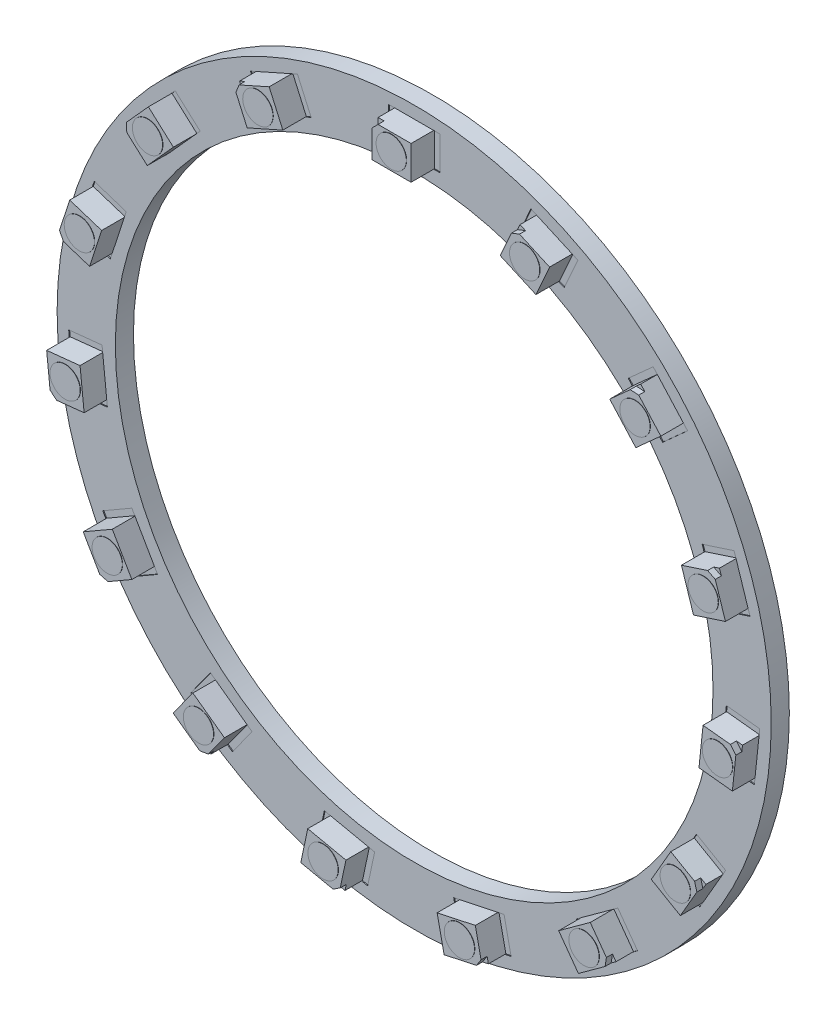
from build123d import *

# Parameters (mm, degrees)
SKETCH1_R           = 29.972
SKETCH1_R_2         = 25.085
BOSS_EXTRUDE1_DEPTH = 1.52
SKETCH2_W           = 3.2766
SKETCH2_H           = 2.8194
BOSS_EXTRUDE2_DEPTH = 1.9
CUT_EXTRUDE3_DEPTH  = 0.508
SKETCH5_R           = 1.27
BOSS_EXTRUDE4_DEPTH = 0.0254
SKETCH6_W           = 0.5207
SKETCH6_H           = 2.8194
CUT_EXTRUDE8_DEPTH  = 0.0762
CIRPATTERN1_COUNT   = 15
CIRPATTERN2_COUNT   = 15
CIRPATTERN3_COUNT   = 15
CIRPATTERN4_COUNT   = 15


with BuildPart() as part:
    # Sketch1 → Boss-Extrude1 (new body)
    with BuildSketch(Plane.XY):
        Circle(SKETCH1_R)
        Circle(SKETCH1_R_2, mode=Mode.SUBTRACT)
    extrude(amount=BOSS_EXTRUDE1_DEPTH)

    # Sketch2 → Boss-Extrude2 (add)
    with BuildSketch(Plane.XY.offset(1.52)):
        with Locations((0, 27.5285)):
            Rectangle(SKETCH2_W, SKETCH2_H)
    boss_extrude2 = extrude(amount=BOSS_EXTRUDE2_DEPTH)

    # Sketch3 → Cut-Extrude3 (cut)
    with BuildSketch(Plane.XY.offset(3.42)):
        Polygon((-1.6383, 28.4302), (-1.1303, 28.9382), (-1.6383, 28.9382), align=None)
    cut_extrude3 = extrude(amount=-CUT_EXTRUDE3_DEPTH, mode=Mode.SUBTRACT)

    # Sketch5 → Boss-Extrude4 (add)
    with BuildSketch(Plane.XY.offset(3.42)):
        with Locations(Location((0, 27.5285, 0), (0, 0, 180))):
            Circle(SKETCH5_R)
    boss_extrude4 = extrude(amount=BOSS_EXTRUDE4_DEPTH)

    # Sketch6 → Cut-Extrude8 (cut)
    with BuildSketch(Plane.XY.offset(1.52)):
        with Locations((1.89865, 27.5285)):
            Rectangle(SKETCH6_W, SKETCH6_H)
        with Locations((-1.89865, 27.5285)):
            Rectangle(SKETCH6_W, SKETCH6_H)
    cut_extrude8 = extrude(amount=-CUT_EXTRUDE8_DEPTH, mode=Mode.SUBTRACT)

    # CirPattern1: Boss-Extrude2 ×15 about axis
    cirpattern1_axis = Axis((0, 0, 0), (0, 0, 1))
    for i in range(1, CIRPATTERN1_COUNT):
        add(boss_extrude2.rotate(cirpattern1_axis, i * 360 / CIRPATTERN1_COUNT))

    # CirPattern2: Cut-Extrude3 ×15 about axis
    cirpattern2_axis = Axis((0, 0, 0), (0, 0, 1))
    for i in range(1, CIRPATTERN2_COUNT):
        add(cut_extrude3.rotate(cirpattern2_axis, i * 360 / CIRPATTERN2_COUNT), mode=Mode.SUBTRACT)

    # CirPattern3: Boss-Extrude4 ×15 about axis
    cirpattern3_axis = Axis((0, 0, 0), (0, 0, 1))
    for i in range(1, CIRPATTERN3_COUNT):
        add(boss_extrude4.rotate(cirpattern3_axis, i * 360 / CIRPATTERN3_COUNT))

    # CirPattern4: Cut-Extrude8 ×15 about axis
    cirpattern4_axis = Axis((0, 0, 0), (0, 0, 1))
    for i in range(1, CIRPATTERN4_COUNT):
        add(cut_extrude8.rotate(cirpattern4_axis, i * 360 / CIRPATTERN4_COUNT), mode=Mode.SUBTRACT)


solid = part.part
